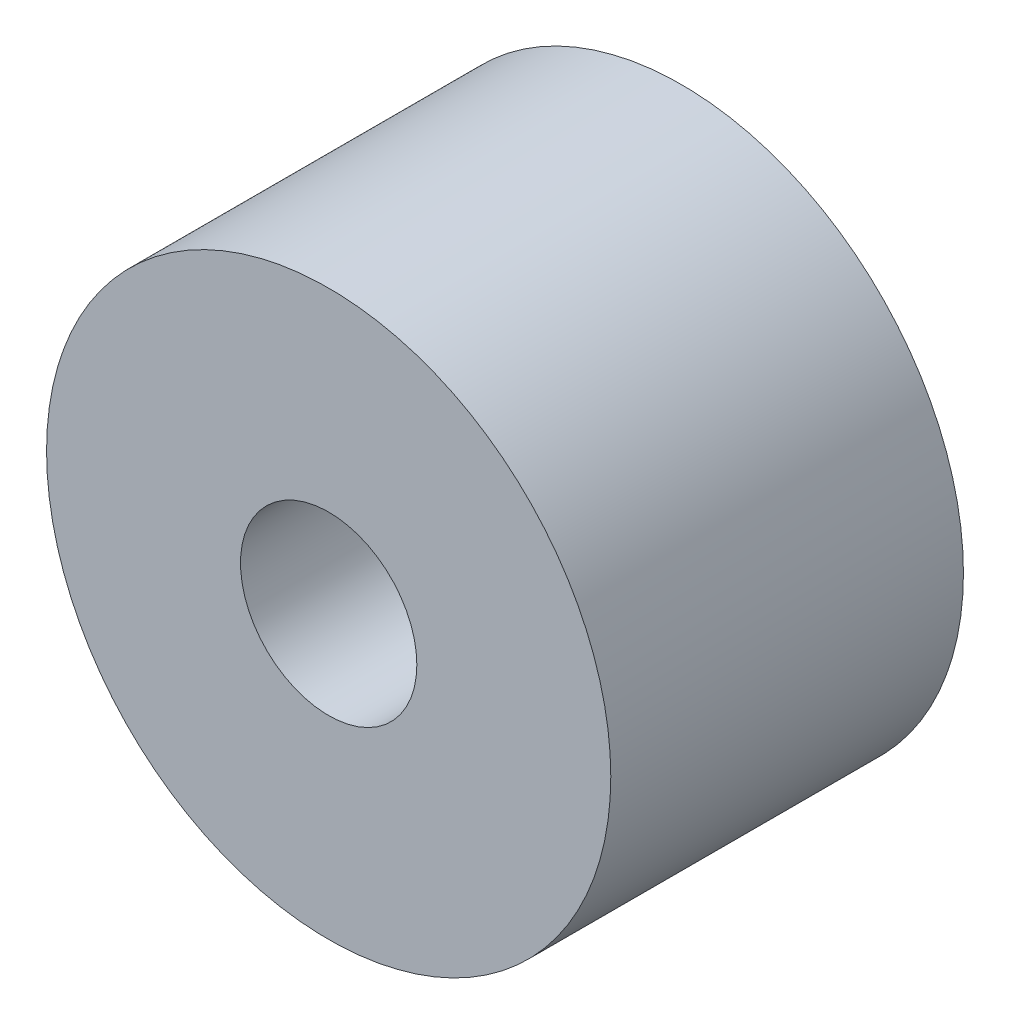
from build123d import *

# Parameters (mm, degrees)
SKETCH1_R           = 5.08
SKETCH1_R_2         = 1.5875
BOSS_EXTRUDE1_DEPTH = 6.35


with BuildPart() as part:
    # Sketch1 → Boss-Extrude1 (new body)
    with BuildSketch(Plane.XY):
        Circle(SKETCH1_R)
        Circle(SKETCH1_R_2, mode=Mode.SUBTRACT)
    extrude(amount=BOSS_EXTRUDE1_DEPTH)


solid = part.part
